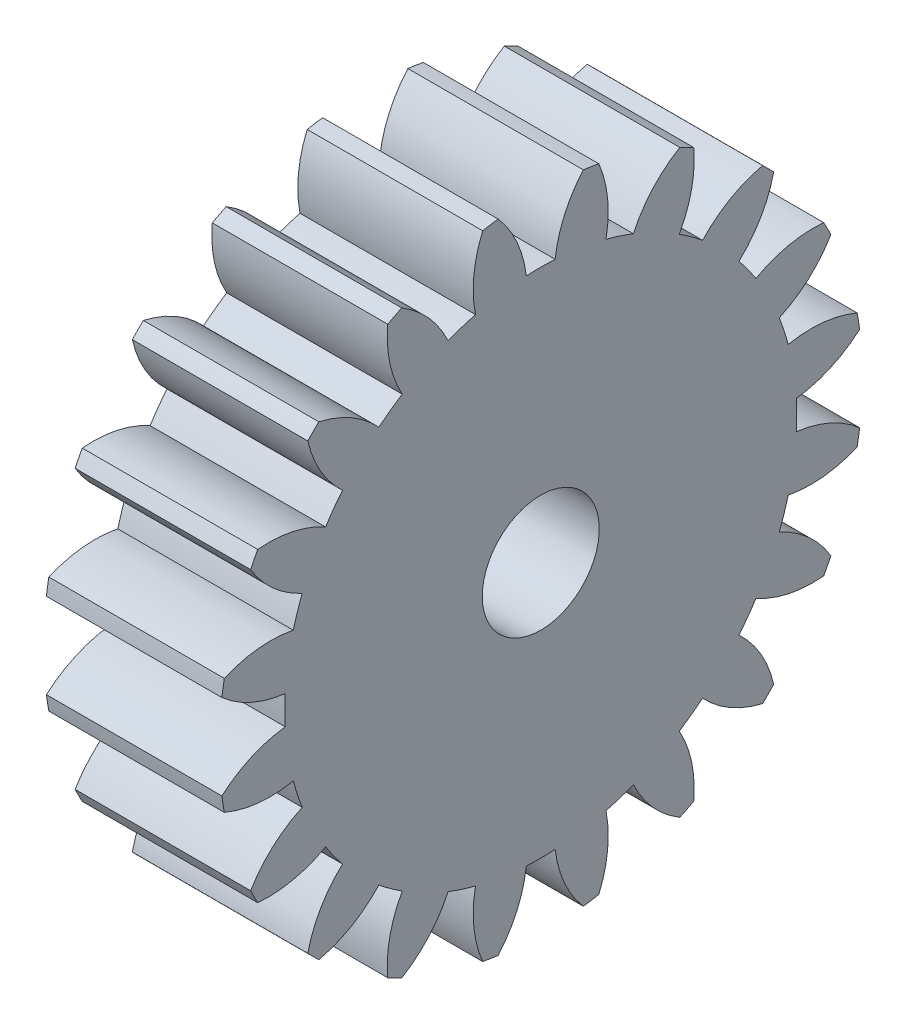
from build123d import *

# Parameters (mm, degrees)
BASPROSKE_W     = 30
BASPROSKE_H     = 55
TOOTHCUT_DEPTH  = 84.366660003
TEETHCUTS_COUNT = 20
TEETHCUTS_ANGLE = 342
BORSKE_R        = 10
BORE_DEPTH      = 50.0000508


with BuildPart() as part:
    # BasProSke → Base-Revolve (revolve)
    with BuildSketch(Plane(origin=(0, 0, 0), x_dir=(1, 0, 0), z_dir=(0, 1, 0)), mode=Mode.PRIVATE) as base_revolve_sk:
        with Locations((15, 27.5)):
            Rectangle(BASPROSKE_W, BASPROSKE_H)
    revolve(base_revolve_sk.sketch.rotate(Axis((-10, 0, 0), (1, 0, 0)), 180), axis=Axis((-10, 0, 0), (1, 0, 0)))

    # TooCutSke → ToothCut (cut, through all)
    with BuildSketch(Plane(origin=(0, 0, 0), x_dir=(0, 0, -1), z_dir=(1, 0, 0))):
        with BuildLine():
            ThreePointArc((2.464838288, 43.679509764), (0, 43.749), (-2.464838288, 43.679509764))
            ThreePointArc((-2.464838288, 43.679509764), (-4.057398861, 49.476814676), (-7.300899231, 54.538899105))
            ThreePointArc((-7.300899231, 54.538899105), (0, 55.0254), (7.300899231, 54.538899105))
            ThreePointArc((7.300899231, 54.538899105), (4.057398861, 49.476814676), (2.464838288, 43.679509764))
        make_face()
    toothcut = extrude(amount=TOOTHCUT_DEPTH, mode=Mode.SUBTRACT)

    # TeethCuts: ToothCut ×20 about axis
    teethcuts_axis = Axis((-10, 0, 0), (1, 0, 0))
    for i in range(1, TEETHCUTS_COUNT):
        add(toothcut.rotate(teethcuts_axis, i * TEETHCUTS_ANGLE / (TEETHCUTS_COUNT - 1)), mode=Mode.SUBTRACT)

    # BorSke → Bore (cut, symmetric)
    with BuildSketch(Plane(origin=(0, 0, 0), x_dir=(0, 0, -1), z_dir=(1, 0, 0))):
        with Locations(Location((0, 0, 0), (0, 0, 180))):
            Circle(BORSKE_R)
    extrude(amount=BORE_DEPTH, both=True, mode=Mode.SUBTRACT)


solid = part.part
